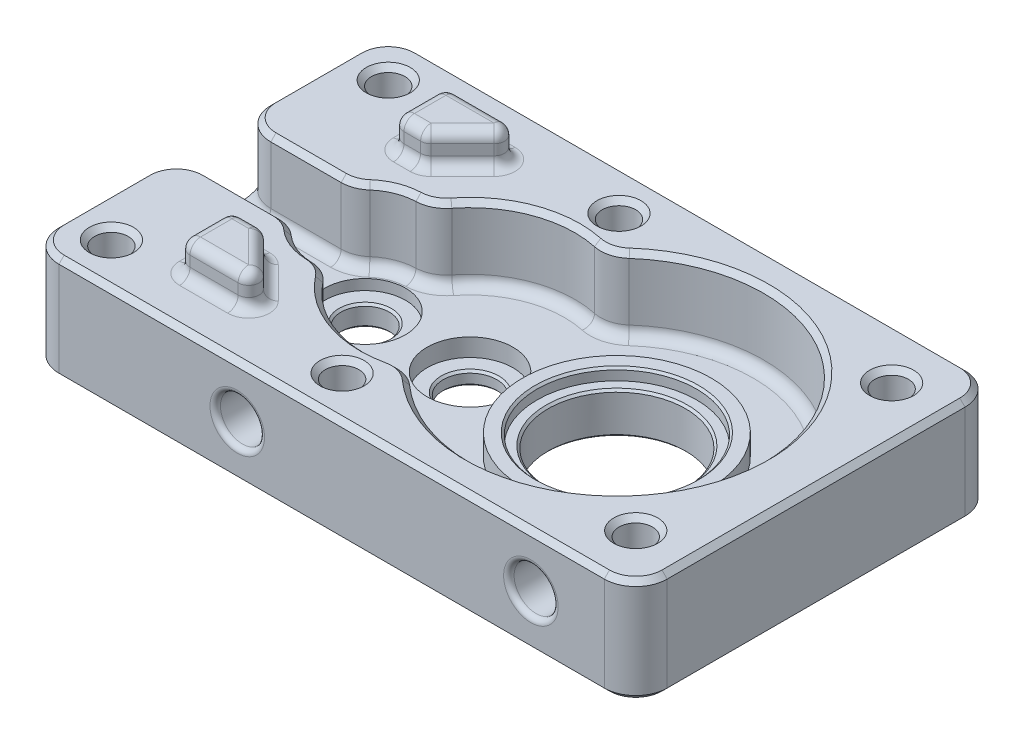
from build123d import *

# Parameters (mm, degrees)
BOSS_EXTRUDE1_DEPTH       = 3
CUT_EXTRUDE1_START        = -3
SKETCH2_R                 = 3.85
CUT_EXTRUDE1_DEPTH        = 1
SKETCH3_R                 = 2.3
CUT_EXTRUDE2_DEPTH        = 47.35558218812488
BOSS_EXTRUDE2_DEPTH       = 7
CUT_EXTRUDE3_DEPTH        = 7
CUT_EXTRUDE4_START        = -3
SKETCH6_R                 = 4.099999999999999
CUT_EXTRUDE4_DEPTH        = 1.7
SKETCH7_R                 = 2.5500000000000007
CUT_EXTRUDE5_DEPTH        = 48.122499933683486
SKETCH14_R                = 9.000000000000004
BOSS_EXTRUDE4_DEPTH       = 2
SKETCH15_R                = 6.550000000000002
CUT_EXTRUDE11_DEPTH       = 47.581541408588016
SKETCH16_R                = 7.6000000000000005
CUT_EXTRUDE12_DEPTH       = 1.1
FILLET1_R                 = 3
FILLET2_R                 = 3
FILLET3_R                 = 1
SKETCH10_R                = 1.6000000000000019
CUT_EXTRUDE8_DEPTH        = 48.37974265485198
SKETCH11_R                = 1.5999999999999979
CUT_EXTRUDE9_DEPTH        = 48.37974265485198
SKETCH12_R                = 2.0999999999999974
CUT_EXTRUDE10_DEPTH       = 5
BOSS_EXTRUDE3_DEPTH       = 3
FILLET4_R                 = 1
FILLET5_R                 = 1
FILLET4_OF_MIRROR2_R      = 1
FILLET5_OF_MIRROR2_R      = 1
SKETCH18_R                = 2.099999999999997
CUT_EXTRUDE14_DEPTH       = 5
LPATTERN1_COUNT           = 2
LPATTERN1_PITCH           = 28
LPATTERN1_COPY_1_SKETCH_R = 2.099999999999997
LPATTERN1_COPY_1_DEPTH    = 5
FILLET6_R                 = 0.5
CHAMFER2_SIZE             = 0.5
CHAMFER3_SIZE             = 0.2


with BuildPart() as part:
    # Sketch1 → Boss-Extrude1 (new body)
    with BuildSketch(Plane(origin=(0, 27.999999999999996, 0), x_dir=(1, 0, 0), z_dir=(0, 1, 0))):
        Polygon((43, -17.199999999999992), (-15, -17.2), (-15, 17.2), (43, 17.199999999999992), align=None)
    extrude(amount=BOSS_EXTRUDE1_DEPTH)

    # Sketch2 → Cut-Extrude1 (cut)
    with BuildSketch(Plane.XZ.offset(-27.999999999999996).offset(CUT_EXTRUDE1_START)):
        with Locations(Location((0, 0, 0), (0, 0, 270))):
            Circle(SKETCH2_R)
    extrude(amount=CUT_EXTRUDE1_DEPTH, mode=Mode.SUBTRACT)

    # Sketch3 → Cut-Extrude2 (cut, through all)
    with BuildSketch(Plane(origin=(0, 29.999999999999996, 0), x_dir=(-1, 0, 0), z_dir=(0, 1, 0))):
        with Locations(Location((0, 0, 0), (0, 0, 90))):
            Circle(SKETCH3_R)
    extrude(amount=-CUT_EXTRUDE2_DEPTH, mode=Mode.SUBTRACT)

    # Sketch4 → Boss-Extrude2 (add)
    with BuildSketch(Plane(origin=(0, 30.999999999999996, 0), x_dir=(1, 0, 0), z_dir=(0, 1, 0))):
        Polygon((-15, -17.2), (43, -17.199999999999992), (43, 17.199999999999992), (-15, 17.2), align=None)
        with BuildLine():
            ThreePointArc((1.25, 4.841229182759271), (-5, 6.1e-16), (1.25, -4.841229182759271))
            ThreePointArc((1.25, -4.841229182759271), (6.569948267284286, -9.39333514311578), (13.571428571428571, -9.340497736158586))
            ThreePointArc((13.571428571428571, -9.340497736158586), (38, 0), (13.571428571428571, 9.340497736158586))
            ThreePointArc((13.571428571428571, 9.340497736158586), (6.569948267284286, 9.39333514311578), (1.25, 4.841229182759271))
        make_face(mode=Mode.SUBTRACT)
    extrude(amount=BOSS_EXTRUDE2_DEPTH)

    # Sketch5 → Cut-Extrude3 (cut)
    with BuildSketch(Plane(origin=(0, 38, 0), x_dir=(1, 0, 0), z_dir=(0, 1, 0))):
        Polygon((-4.000000000000002, 2.9999999999999987), (-4.000000000000002, -2.9999999999999987), (-15, -3), (-15, 3), align=None)
    extrude(amount=-CUT_EXTRUDE3_DEPTH, mode=Mode.SUBTRACT)

    # Sketch6 → Cut-Extrude4 (cut)
    with BuildSketch(Plane.XZ.offset(-27.999999999999996).offset(CUT_EXTRUDE4_START)):
        with Locations(Location((10, 0, 0), (0, 0, 270))):
            Circle(SKETCH6_R)
    extrude(amount=CUT_EXTRUDE4_DEPTH, mode=Mode.SUBTRACT)

    # Sketch7 → Cut-Extrude5 (cut, through all)
    with BuildSketch(Plane(origin=(0, 29.299999999999997, 0), x_dir=(-1, 0, 0), z_dir=(0, 1, 0))):
        with Locations(Location((-10, 0, 0), (0, 0, 90))):
            Circle(SKETCH7_R)
    extrude(amount=-CUT_EXTRUDE5_DEPTH, mode=Mode.SUBTRACT)

    # Sketch14 → Boss-Extrude4 (add)
    with BuildSketch(Plane(origin=(0, 30.999999999999996, 0), x_dir=(1, 0, 0), z_dir=(0, 1, 0))):
        with Locations(Location((24, 0, 0), (0, 0, 90))):
            Circle(SKETCH14_R)
    extrude(amount=BOSS_EXTRUDE4_DEPTH)

    # Sketch15 → Cut-Extrude11 (cut, through all)
    with BuildSketch(Plane(origin=(0, 32.99999999999999, 0), x_dir=(1, 0, 0), z_dir=(0, 1, 0))):
        with Locations(Location((24, 0, 0), (0, 0, 270))):
            Circle(SKETCH15_R)
    extrude(amount=-CUT_EXTRUDE11_DEPTH, mode=Mode.SUBTRACT)

    # Sketch16 → Cut-Extrude12 (cut)
    with BuildSketch(Plane(origin=(0, 32.99999999999999, 0), x_dir=(1, 0, 0), z_dir=(0, 1, 0))):
        with Locations(Location((24, 0, 0), (0, 0, 270))):
            Circle(SKETCH16_R)
    extrude(amount=-CUT_EXTRUDE12_DEPTH, mode=Mode.SUBTRACT)

    # Fillet1
    fillet1_edges = [part.edges().sort_by_distance(p)[0] for p in [
        (43, 33, 17.199999999999992),
        (43, 33, -17.199999999999992),
        (-15, 33, -17.2),
        (-15, 33, 17.2),
    ]]
    fillet(fillet1_edges, radius=FILLET1_R)

    # Fillet2
    fillet2_edges = [part.edges().sort_by_distance(p)[0] for p in [
        (1.2499999999999991, 34.5, -4.841229182759271),
        (1.2500000000000002, 34.5, 4.841229182759271),
        (13.57142857142857, 34.5, 9.340497736158586),
        (13.571428571428573, 34.5, -9.34049773615859),
        (-15, 34.5, -3),
        (-4.000000000000002, 34.5, -2.9999999999999987),
        (-4.000000000000002, 34.5, 2.9999999999999987),
        (-15, 34.5, 3),
    ]]
    fillet(fillet2_edges, radius=FILLET2_R)

    # Fillet3
    fillet3_edges = [part.edges().sort_by_distance(p)[0] for p in [
        (-8.645751311064593, 31, 2.999999999999999),
        (-8.645751311064592, 31, -2.999999999999999),
        (6.580581876008894, 30.999999999999996, 9.39721127214458),
        (38, 30.999999999999996, 2.66e-15),
        (-1.8406392656691377, 30.999999999999996, 4.6488758957060785),
        (-1.8406392656691395, 30.999999999999996, -4.648875895706076),
        (6.580581876008893, 30.999999999999996, -9.39721127214458),
        (-14.121320343559642, 31, 3.878679656440358),
        (-14.121320343559642, 31, -3.8786796564403594),
        (13.479201119211181, 31, 9.812637653753823),
        (1.108068835346198, 31, 5.321088302693153),
        (-4.230842450349362, 31, 3.1937569599195426),
        (-4.2308424503493605, 31, -3.1937569599195426),
        (13.479201119211085, 31, -9.812637653753796),
        (1.1080688353461077, 31, -5.3210883026931075),
    ]]
    fillet(fillet3_edges, radius=FILLET3_R)

    # Sketch10 → Cut-Extrude8 (cut, through all)
    with BuildSketch(Plane.XZ.offset(-27.999999999999996)):
        with Locations(Location((-11.000000000000004, -13.200000000000005, 0), (0, 0, 270))):
            Circle(SKETCH10_R)
        with Locations(Location((10.999999999999996, -13.200000000000008, 0), (0, 0, 270))):
            Circle(SKETCH10_R)
        with Locations(Location((-11.000000000000004, 13.199999999999994, 0), (0, 0, 270))):
            Circle(SKETCH10_R)
        with Locations(Location((10.999999999999996, 13.199999999999994, 0), (0, 0, 270))):
            Circle(SKETCH10_R)
    extrude(amount=-CUT_EXTRUDE8_DEPTH, mode=Mode.SUBTRACT)

    # Sketch11 → Cut-Extrude9 (cut, through all)
    with BuildSketch(Plane.XZ.offset(-27.999999999999996)):
        with Locations(Location((38.00000000000001, -12.199999999999992, 0), (0, 0, 270))):
            Circle(SKETCH11_R)
    cut_extrude9 = extrude(amount=-CUT_EXTRUDE9_DEPTH, mode=Mode.SUBTRACT)

    # Sketch12 → Cut-Extrude10 (cut)
    with BuildSketch(Plane.XZ.offset(-27.999999999999996)):
        with Locations(Location((38.00000000000001, -12.199999999999992, 0), (0, 0, 270))):
            Circle(SKETCH12_R)
    cut_extrude10 = extrude(amount=-CUT_EXTRUDE10_DEPTH, mode=Mode.SUBTRACT)

    # Mirror1: Cut-Extrude9, Cut-Extrude10 across plane
    add(cut_extrude9.mirror(Plane.XY), mode=Mode.SUBTRACT)
    add(cut_extrude10.mirror(Plane.XY), mode=Mode.SUBTRACT)

    # Sketch13 → Boss-Extrude3 (add)
    with BuildSketch(Plane(origin=(0, 38, 0), x_dir=(1, 0, 0), z_dir=(0, 1, 0))):
        Polygon((3.000000000000001, -12.7), (-4.999999999999999, -12.700000000000001), (-4.999999999999999, -7.700000000000001), (-2.0000000000000533, -7.700000000000001), align=None)
    boss_extrude3 = extrude(amount=BOSS_EXTRUDE3_DEPTH)

    # Fillet4
    fillet4_edges = [part.edges().sort_by_distance(p)[0] for p in [
        (3.000000000000001, 39.5, 12.7),
        (-2.0000000000000533, 39.5, 7.700000000000001),
        (-4.999999999999999, 39.5, 7.700000000000001),
        (-4.999999999999999, 39.5, 12.700000000000001),
        (0.4999999999999738, 41, 10.2),
        (-3.500000000000026, 41, 7.700000000000001),
        (-4.999999999999999, 41, 10.200000000000001),
        (-0.9999999999999991, 41, 12.7),
    ]]
    fillet(fillet4_edges, radius=FILLET4_R)

    # Fillet5
    fillet5_edges = [part.edges().sort_by_distance(p)[0] for p in [
        (-1.7071067811865541, 38, 12.700000000000001),
        (-4.999999999999999, 38, 10.200000000000001),
        (-3.207106781186571, 38, 7.700000000000001),
        (-0.20710678118658454, 38, 9.49289321881345),
        (-2.031530130008058, 38, 7.776120467488713),
        (-4.707106781186546, 38, 7.992893218813453),
        (-4.707106781186547, 38, 12.407106781186549),
        (1.5096659701381776, 38, 12.082683432365087),
    ]]
    fillet(fillet5_edges, radius=FILLET5_R)

    # Mirror2: Boss-Extrude3 across plane
    add(boss_extrude3.mirror(Plane.XY))

    # Fillet4 of Mirror2
    fillet4_of_mirror2_edges = [part.edges().sort_by_distance(p)[0] for p in [
        (3.000000000000001, 39.5, -12.7),
        (-2.0000000000000533, 39.5, -7.700000000000001),
        (-4.999999999999999, 39.5, -7.700000000000001),
        (-4.999999999999999, 39.5, -12.700000000000001),
        (0.4999999999999738, 41, -10.2),
        (-3.500000000000026, 41, -7.700000000000001),
        (-4.999999999999999, 41, -10.200000000000001),
        (-0.9999999999999991, 41, -12.7),
    ]]
    fillet(fillet4_of_mirror2_edges, radius=FILLET4_OF_MIRROR2_R)

    # Fillet5 of Mirror2
    fillet5_of_mirror2_edges = [part.edges().sort_by_distance(p)[0] for p in [
        (-1.7071067811865541, 38, -12.700000000000001),
        (-4.999999999999999, 38, -10.200000000000001),
        (-3.207106781186571, 38, -7.700000000000001),
        (-0.20710678118658454, 38, -9.49289321881345),
        (-2.031530130008058, 38, -7.776120467488713),
        (-4.707106781186546, 38, -7.992893218813453),
        (-4.707106781186547, 38, -12.407106781186549),
        (1.5096659701381776, 38, -12.082683432365087),
    ]]
    fillet(fillet5_of_mirror2_edges, radius=FILLET5_OF_MIRROR2_R)

    # Sketch18 → Cut-Extrude14 (cut)
    with BuildSketch(Plane(origin=(2.06e-15, 0, -17.199999999999996), x_dir=(-1, 0, -1.2e-16), z_dir=(1.2e-16, 0, -1))):
        with Locations((-33, 33)):
            Circle(SKETCH18_R)
    cut_extrude14 = extrude(amount=-CUT_EXTRUDE14_DEPTH, mode=Mode.SUBTRACT)

    # Mirror3: Cut-Extrude14 across plane
    add(cut_extrude14.mirror(Plane.XY), mode=Mode.SUBTRACT)

    # LPattern1: Cut-Extrude14 ×2
    with Locations(*[(-i * LPATTERN1_PITCH, 0, 0) for i in range(1, LPATTERN1_COUNT)]):
        add(cut_extrude14, mode=Mode.SUBTRACT)

    # LPattern1 copy 1 sketch → LPattern1 copy 1 (cut)
    with BuildSketch(Plane(origin=(-27.999999999999996, 0, 17.199999999999992), x_dir=(-1, 0, 1.2e-16), z_dir=(1.2e-16, 0, 1))):
        with Locations((-33, -33)):
            Circle(LPATTERN1_COPY_1_SKETCH_R)
    extrude(amount=-LPATTERN1_COPY_1_DEPTH, mode=Mode.SUBTRACT)

    # Fillet6
    fillet6_edges = [part.edges().sort_by_distance(p)[0] for p in [
        (35.099999999999994, 33, -17.199999999999992),
        (35.099999999999994, 33, 17.199999999999996),
        (7.099999999999998, 33, 17.19999999999999),
        (7.099999999999998, 33, -17.199999999999996),
    ]]
    fillet(fillet6_edges, radius=FILLET6_R)

    # Chamfer2
    chamfer2_edges = [part.edges().sort_by_distance(p)[0] for p in [
        (-8.645751311064593, 38, 2.999999999999999),
        (-15, 38, 10.099999999999998),
        (-8.645751311064592, 38, -2.999999999999999),
        (-1.8406392656691382, 38, -4.648875895706076),
        (6.580581876008893, 38, -9.39721127214458),
        (38, 38, -3.55e-15),
        (6.5805818760088926, 38, 9.397211272144578),
        (-1.8406392656691377, 38, 4.6488758957060785),
        (1.1080688353461101, 38, -5.321088302693107),
        (13.479201119211085, 38, -9.812637653753796),
        (-4.2308424503493605, 38, -3.1937569599195426),
        (-4.230842450349362, 38, 3.1937569599195426),
        (1.108068835346198, 38, 5.321088302693153),
        (13.47920111921118, 38, 9.81263765375382),
        (-14.121320343559642, 38, -3.8786796564403594),
        (-14.121320343559642, 38, 3.878679656440358),
        (10.999999999999996, 38, -11.600000000000007),
        (-11.000000000000004, 38, 14.799999999999995),
        (10.999999999999996, 38, 14.799999999999995),
        (-11.000000000000004, 38, -11.600000000000003),
        (38.00000000000001, 38, -10.599999999999994),
        (38.00000000000001, 38, 10.599999999999994),
        (14, 27.999999999999996, 17.199999999999996),
        (14, 38, 17.199999999999996),
        (-15, 27.999999999999996, 0),
        (14, 27.999999999999996, -17.199999999999996),
        (43, 27.999999999999996, 0),
        (-14.121320343559642, 27.999999999999996, -16.32132034355964),
        (42.121320343559645, 27.999999999999996, -16.321320343559634),
        (42.121320343559645, 27.999999999999996, 16.321320343559634),
        (-14.121320343559642, 27.999999999999996, 16.32132034355964),
        (-15, 38, -10.100000000000001),
        (43, 38, 0),
        (14, 38, -17.199999999999996),
        (-14.121320343559642, 38, -16.32132034355964),
        (42.121320343559645, 38, -16.321320343559634),
        (42.121320343559645, 38, 16.321320343559634),
        (-14.121320343559642, 38, 16.32132034355964),
    ]]
    chamfer(chamfer2_edges, length=CHAMFER2_SIZE)

    # Chamfer3
    chamfer3_edges = [part.edges().sort_by_distance(p)[0] for p in [
        (4.2e-16, 27.999999999999996, -2.3),
        (4.2e-16, 29.999999999999996, -2.3),
        (10.999999999999996, 27.999999999999996, -11.600000000000007),
        (-11.000000000000004, 27.999999999999996, 14.799999999999995),
        (10.999999999999996, 27.999999999999996, 14.799999999999995),
        (-11.000000000000004, 27.999999999999996, -11.600000000000003),
        (38.00000000000001, 27.999999999999996, -10.099999999999994),
        (38.00000000000001, 27.999999999999996, 10.099999999999994),
        (10, 27.999999999999996, -2.5500000000000007),
        (10, 29.299999999999997, -2.5500000000000007),
        (24.000000000000004, 27.999999999999996, -6.550000000000002),
        (24.000000000000004, 32.99999999999999, -7.6000000000000005),
        (24.000000000000004, 31.89999999999999, -6.550000000000002),
    ]]
    chamfer(chamfer3_edges, length=CHAMFER3_SIZE)


solid = part.part
